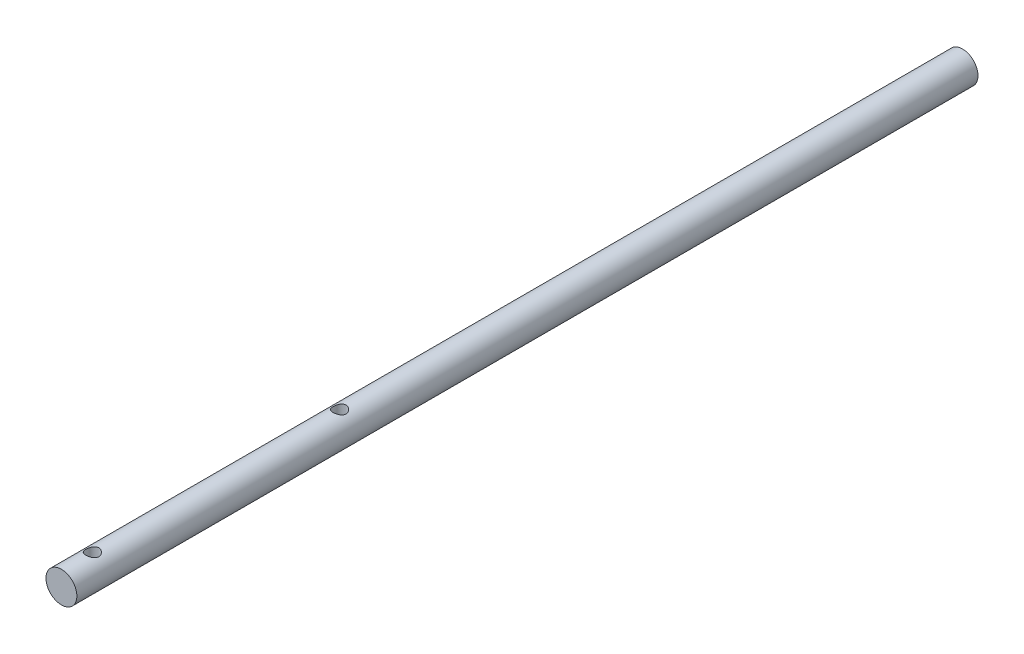
from build123d import *

# Parameters (mm, degrees)
ESQUISSE1_R                  = 3
BOSS_EXTRU_1_DEPTH           = 175
ENL_V_MAT_EXTRU_1_DEPTH      = 176.051421017
ENL_V_MAT_EXTRU_1_DEPTH_BACK = 176.051421017
ESQUISSE2_R                  = 1.25


with BuildPart() as part:
    # Esquisse1 → Boss.-Extru.1 (new body)
    with BuildSketch(Plane.XY):
        Circle(ESQUISSE1_R)
    extrude(amount=BOSS_EXTRU_1_DEPTH)

    # Esquisse2 → Enlèv. mat.-Extru.1 (cut, two sides: drawn at the far end of the back side and taken through both)
    with BuildSketch(Plane(origin=(0, 0, 0), x_dir=(1, 0, 0), z_dir=(0, 1, 0)).offset(-ENL_V_MAT_EXTRU_1_DEPTH_BACK)):
        with Locations(Location((0, -121, 0), (0, 0, 270))):
            Circle(ESQUISSE2_R)
        with Locations(Location((0, -169, 0), (0, 0, 270))):
            Circle(ESQUISSE2_R)
    extrude(amount=ENL_V_MAT_EXTRU_1_DEPTH + ENL_V_MAT_EXTRU_1_DEPTH_BACK, mode=Mode.SUBTRACT)


solid = part.part
